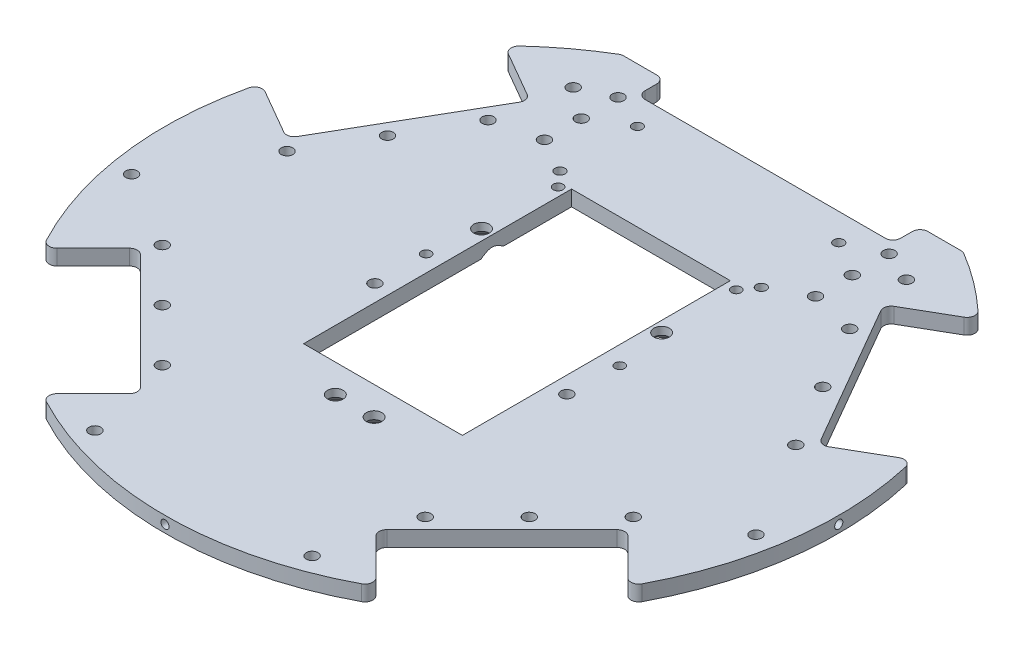
from build123d import *

# Parameters (mm, degrees)
BOSS_EXTRUDE1_DEPTH           = 2
FILLET1_R                     = 2
CSK_FOR_M3_SFHCS1_D           = 3
CSK_FOR_M3_SFHCS1_DEPTH       = 9.5
CSK_FOR_M3_SFHCS1_CSINK_D     = 5.6
CSK_FOR_M3_SFHCS1_CSINK_ANGLE = 90
CSK_FOR_M3_SFHCS1_TIP         = 0.901290929
CSK_FOR_M3_SFHCS2_D           = 3
CSK_FOR_M3_SFHCS2_DEPTH       = 9.5
CSK_FOR_M3_SFHCS2_CSINK_D     = 5.6
CSK_FOR_M3_SFHCS2_CSINK_ANGLE = 90
CSK_FOR_M3_SFHCS2_TIP         = 0.901290929
CSK_FOR_M3_SFHCS3_D           = 2.6
CSK_FOR_M3_SFHCS3_DEPTH       = 9.5
CSK_FOR_M3_SFHCS3_CSINK_D     = 4.6
CSK_FOR_M3_SFHCS3_CSINK_ANGLE = 90
CSK_FOR_M3_SFHCS3_TIP         = 0.781118805
CSK_FOR_M4_SFHCS3_D           = 4
CSK_FOR_M4_SFHCS3_DEPTH       = 9.5
CSK_FOR_M4_SFHCS3_CSINK_D     = 8
CSK_FOR_M4_SFHCS3_CSINK_ANGLE = 90
CSK_FOR_M4_SFHCS3_TIP         = 1.201721238
CSK_FOR_M3_SFHCS4_D           = 3
CSK_FOR_M3_SFHCS4_DEPTH       = 9.5
CSK_FOR_M3_SFHCS4_CSINK_D     = 5.6
CSK_FOR_M3_SFHCS4_CSINK_ANGLE = 90
CSK_FOR_M3_SFHCS4_TIP         = 0.901290929
SKETCH9_R                     = 1.05
CUT_EXTRUDE1_DEPTH            = 8
SKETCH10_R                    = 1.05
CUT_EXTRUDE2_DEPTH            = 8
SKETCH11_R                    = 1.05
CUT_EXTRUDE3_DEPTH            = 8
M2_5X0_45_TAPPED_HOLE1_D      = 2.05
M2_5X0_45_TAPPED_HOLE1_DEPTH  = 6.35
M2_5X0_45_TAPPED_HOLE1_TIP    = 0.615882135
CUT_EXTRUDE4_REACH            = 125.102
SKETCH21_R                    = 1.25
SKETCH23_W                    = 66
SKETCH23_H                    = 4
CUT_EXTRUDE6_DEPTH            = 1
FILLET2_R                     = 2
SKETCH24_W                    = 41
SKETCH24_H                    = 69.2
CUT_EXTRUDE9_DEPTH            = 10


with BuildPart() as part:
    # Sketch1 → Boss-Extrude1 (new, symmetric)
    with BuildSketch(Plane(origin=(0, 0, 0), x_dir=(1, 0, 0), z_dir=(0, 1, 0))):
        with BuildLine():
            Line((45.65767665, 52.918584287), (68.65767665, 13.081415713))
            Line((68.65767665, 13.081415713), (84.163608498, 22.03376964))
            ThreePointArc((84.163608498, 22.03376964), (86.25570294, -11.355778723), (75.593043864, -43.066131929))
            Line((75.593043864, -43.066131929), (62.932503526, -30.405591591))
            Line((62.932503526, -30.405591591), (30.405591591, -62.932503526))
            Line((30.405591591, -62.932503526), (43.066131929, -75.593043864))
            ThreePointArc((43.066131929, -75.593043864), (0, -87), (-43.066131929, -75.593043864))
            Line((-43.066131929, -75.593043864), (-30.405591591, -62.932503526))
            Line((-30.405591591, -62.932503526), (-62.932503526, -30.405591591))
            Line((-62.932503526, -30.405591591), (-75.593043864, -43.066131929))
            ThreePointArc((-75.593043864, -43.066131929), (-86.25570294, -11.355778723), (-84.163608498, 22.03376964))
            Line((-84.163608498, 22.03376964), (-68.65767665, 13.081415713))
            Line((-68.65767665, 13.081415713), (-45.65767665, 52.918584287))
            Line((-45.65767665, 52.918584287), (-61.163608498, 61.870938214))
            ThreePointArc((-61.163608498, 61.870938214), (-53.035049748, 68.965813982), (-44.09081537, 75))
            Line((-44.09081537, 75), (-33, 75))
            Line((-33, 75), (-33, 69))
            Line((-33, 69), (33, 69))
            Line((33, 69), (33, 75))
            Line((33, 75), (44.09081537, 75))
            ThreePointArc((44.09081537, 75), (53.035049748, 68.965813982), (61.163608498, 61.870938214))
            Line((61.163608498, 61.870938214), (45.65767665, 52.918584287))
        make_face()
    extrude(amount=BOSS_EXTRUDE1_DEPTH, both=True)

    # Fillet1
    fillet1_edges = [part.edges().sort_by_distance(p)[0] for p in [
        (33, 0, -75),
        (44.09081537, 0, -75),
        (61.163608498, 0, -61.870938214),
        (45.65767665, 0, -52.918584287),
        (68.65767665, 0, -13.081415713),
        (84.163608498, 0, -22.03376964),
        (75.593043864, 0, 43.066131929),
        (62.932503526, 0, 30.405591591),
        (30.405591591, 0, 62.932503526),
        (43.066131929, 0, 75.593043864),
        (-43.066131929, 0, 75.593043864),
        (-30.405591591, 0, 62.932503526),
        (-62.932503526, 0, 30.405591591),
        (-75.593043864, 0, 43.066131929),
        (-84.163608498, 0, -22.03376964),
        (-68.65767665, 0, -13.081415713),
        (-45.65767665, 0, -52.918584287),
        (-61.163608498, 0, -61.870938214),
        (-44.09081537, 0, -75),
        (-33, 0, -75),
    ]]
    fillet(fillet1_edges, radius=FILLET1_R)

    # CSK for M3 SFHCS1
    with Locations(Plane(origin=(46.693575035, -2, -43.124355653), x_dir=(0, 0, -1), z_dir=(0, -1, 0))):
        with Locations((0, 0), (-16.454482672, 9.5), (-32.908965344, 19), (-69.994413338, 14.117608147), (-83.429442181, 0.682579304), (-96.864471023, -12.752449538), (-96.864471023, -80.634700532), (-83.429442181, -94.069729374), (-69.994413338, -107.504758217), (0, -93.38715007), (-16.454482672, -102.88715007), (-32.908965344, -112.38715007), (21.875644347, -81.693575035), (12.375644347, -81.693575035), (2.875644347, -81.693575035), (2.875644347, -11.693575035), (12.375644347, -11.693575035), (21.875644347, -11.693575035)):
            CounterSinkHole(CSK_FOR_M3_SFHCS1_D / 2, CSK_FOR_M3_SFHCS1_CSINK_D / 2, depth=CSK_FOR_M3_SFHCS1_DEPTH, counter_sink_angle=CSK_FOR_M3_SFHCS1_CSINK_ANGLE)
            with Locations((0, 0, -(CSK_FOR_M3_SFHCS1_DEPTH + CSK_FOR_M3_SFHCS1_TIP / 2))):  # 118° drill point
                Cone(0, CSK_FOR_M3_SFHCS1_D / 2, CSK_FOR_M3_SFHCS1_TIP, mode=Mode.SUBTRACT)

    # CSK for M3 SFHCS2
    with Locations(Plane(origin=(43.018232726, -2, -61.436403322), x_dir=(0, 0, -1), z_dir=(0, -1, 0))):
        with Locations((0, 0), (-76.436403322, 37.598142782), (-138.491198226, -14.972580973), (-138.491198226, -71.063884479), (-76.436403322, -123.634608234), (0, -86.036465452)):
            CounterSinkHole(CSK_FOR_M3_SFHCS2_D / 2, CSK_FOR_M3_SFHCS2_CSINK_D / 2, depth=CSK_FOR_M3_SFHCS2_DEPTH, counter_sink_angle=CSK_FOR_M3_SFHCS2_CSINK_ANGLE)
            with Locations((0, 0, -(CSK_FOR_M3_SFHCS2_DEPTH + CSK_FOR_M3_SFHCS2_TIP / 2))):  # 118° drill point
                Cone(0, CSK_FOR_M3_SFHCS2_D / 2, CSK_FOR_M3_SFHCS2_TIP, mode=Mode.SUBTRACT)

    # CSK for M3 SFHCS3
    with Locations(Plane(origin=(26, -2, -41), x_dir=(0, 0, -1), z_dir=(0, -1, 0))):
        with Locations((0, 0), (20, 0), (0, -52), (20, -52)):
            CounterSinkHole(CSK_FOR_M3_SFHCS3_D / 2, CSK_FOR_M3_SFHCS3_CSINK_D / 2, depth=CSK_FOR_M3_SFHCS3_DEPTH, counter_sink_angle=CSK_FOR_M3_SFHCS3_CSINK_ANGLE)
            with Locations((0, 0, -(CSK_FOR_M3_SFHCS3_DEPTH + CSK_FOR_M3_SFHCS3_TIP / 2))):  # 118° drill point
                Cone(0, CSK_FOR_M3_SFHCS3_D / 2, CSK_FOR_M3_SFHCS3_TIP, mode=Mode.SUBTRACT)

    # CSK for M4 SFHCS3
    with Locations(Plane(origin=(23.25, -2, -18), x_dir=(0, 0, -1), z_dir=(0, -1, 0))):
        with Locations((0, 0), (0, -46.5), (-56, -28.25), (-56, -18.25)):
            CounterSinkHole(CSK_FOR_M4_SFHCS3_D / 2, CSK_FOR_M4_SFHCS3_CSINK_D / 2, depth=CSK_FOR_M4_SFHCS3_DEPTH, counter_sink_angle=CSK_FOR_M4_SFHCS3_CSINK_ANGLE)
            with Locations((0, 0, -(CSK_FOR_M4_SFHCS3_DEPTH + CSK_FOR_M4_SFHCS3_TIP / 2))):  # 118° drill point
                Cone(0, CSK_FOR_M4_SFHCS3_D / 2, CSK_FOR_M4_SFHCS3_TIP, mode=Mode.SUBTRACT)

    # CSK for M3 SFHCS4
    with Locations(Plane(origin=(24.78, -2, 8), x_dir=(0, 0, -1), z_dir=(0, -1, 0))):
        with Locations((0, 0), (0, -49.56)):
            CounterSinkHole(CSK_FOR_M3_SFHCS4_D / 2, CSK_FOR_M3_SFHCS4_CSINK_D / 2, depth=CSK_FOR_M3_SFHCS4_DEPTH, counter_sink_angle=CSK_FOR_M3_SFHCS4_CSINK_ANGLE)
            with Locations((0, 0, -(CSK_FOR_M3_SFHCS4_DEPTH + CSK_FOR_M3_SFHCS4_TIP / 2))):  # 118° drill point
                Cone(0, CSK_FOR_M3_SFHCS4_D / 2, CSK_FOR_M3_SFHCS4_TIP, mode=Mode.SUBTRACT)

    # Sketch9 → Cut-Extrude1 (cut)
    with BuildSketch(Plane(origin=(87, 0, 0), x_dir=(0, 0, -1), z_dir=(1, 0, 0))):
        Circle(SKETCH9_R)
    cut_extrude1 = extrude(amount=-CUT_EXTRUDE1_DEPTH, mode=Mode.SUBTRACT)

    # Sketch10 → Cut-Extrude2 (cut)
    with BuildSketch(Plane.XY.offset(87)):
        Circle(SKETCH10_R)
    cut_extrude2 = extrude(amount=-CUT_EXTRUDE2_DEPTH, mode=Mode.SUBTRACT)

    # Sketch11 → Cut-Extrude3 (cut)
    with BuildSketch(Plane(origin=(52.182278256, 0, -69.613287783), x_dir=(-0.8001527331423806, 0, -0.5997963017931826), z_dir=(0.5997963017931826, 0, -0.8001527331423806))):
        Circle(SKETCH11_R)
    cut_extrude3 = extrude(amount=-CUT_EXTRUDE3_DEPTH, mode=Mode.SUBTRACT)

    # Mirror1: Cut-Extrude1, Cut-Extrude2, Cut-Extrude3 across plane
    add(cut_extrude1.mirror(Plane(origin=(0, 0, 0), x_dir=(0, 0, 1), z_dir=(1, 0, 0))), mode=Mode.SUBTRACT)
    add(cut_extrude2.mirror(Plane(origin=(0, 0, 0), x_dir=(0, 0, 1), z_dir=(1, 0, 0))), mode=Mode.SUBTRACT)
    add(cut_extrude3.mirror(Plane(origin=(0, 0, 0), x_dir=(0, 0, 1), z_dir=(1, 0, 0))), mode=Mode.SUBTRACT)

    # M2.5x0.45 Tapped Hole1
    with Locations(Plane(origin=(-39.271541057, 0, -75), x_dir=(-1, 0, 0), z_dir=(0, 0, -1))):
        with Locations((0, 0), (-78.717182785, 0)):
            Hole(M2_5X0_45_TAPPED_HOLE1_D / 2, depth=M2_5X0_45_TAPPED_HOLE1_DEPTH)
            with Locations((0, 0, -(M2_5X0_45_TAPPED_HOLE1_DEPTH + M2_5X0_45_TAPPED_HOLE1_TIP / 2))):  # 118° drill point
                Cone(0, M2_5X0_45_TAPPED_HOLE1_D / 2, M2_5X0_45_TAPPED_HOLE1_TIP, mode=Mode.SUBTRACT)

    # Sketch21 → Cut-Extrude4 (cut, up to next)
    with BuildSketch(Plane(origin=(0, 2, 0), x_dir=(1, 0, 0), z_dir=(0, 1, 0)), mode=Mode.PRIVATE) as cut_extrude4_sk1:
        with Locations(Location((25.239999926, 5.212655969, 0), (0, 0, 270))):
            Circle(SKETCH21_R)
    cut_extrude4_tool1 = extrude(cut_extrude4_sk1.sketch, amount=-CUT_EXTRUDE4_REACH, mode=Mode.PRIVATE) & part.part
    # Sketch21 → Cut-Extrude4 (cut, up to next)
    with BuildSketch(Plane(origin=(0, 2, 0), x_dir=(1, 0, 0), z_dir=(0, 1, 0)), mode=Mode.PRIVATE) as cut_extrude4_sk2:
        with Locations(Location((23.314999926, 37.212655969, 0), (0, 0, 270))):
            Circle(SKETCH21_R)
    cut_extrude4_tool2 = extrude(cut_extrude4_sk2.sketch, amount=-CUT_EXTRUDE4_REACH, mode=Mode.PRIVATE) & part.part
    # Sketch21 → Cut-Extrude4 (cut, up to next)
    with BuildSketch(Plane(origin=(0, 2, 0), x_dir=(1, 0, 0), z_dir=(0, 1, 0)), mode=Mode.PRIVATE) as cut_extrude4_sk3:
        with Locations(Location((-24.760000074, 5.212655969, 0), (0, 0, 270))):
            Circle(SKETCH21_R)
    cut_extrude4_tool3 = extrude(cut_extrude4_sk3.sketch, amount=-CUT_EXTRUDE4_REACH, mode=Mode.PRIVATE) & part.part
    # Sketch21 → Cut-Extrude4 (cut, up to next)
    with BuildSketch(Plane(origin=(0, 2, 0), x_dir=(1, 0, 0), z_dir=(0, 1, 0)), mode=Mode.PRIVATE) as cut_extrude4_sk4:
        with Locations(Location((-22.685000074, 37.212655969, 0), (0, 0, 270))):
            Circle(SKETCH21_R)
    cut_extrude4_tool4 = extrude(cut_extrude4_sk4.sketch, amount=-CUT_EXTRUDE4_REACH, mode=Mode.PRIVATE) & part.part
    add(cut_extrude4_tool1.solids().sort_by_distance((25.24, 2, -5.212656))[0], mode=Mode.SUBTRACT)
    add(cut_extrude4_tool2.solids().sort_by_distance((23.315, 2, -37.212656))[0], mode=Mode.SUBTRACT)
    add(cut_extrude4_tool3.solids().sort_by_distance((-24.76, 2, -5.212656))[0], mode=Mode.SUBTRACT)
    add(cut_extrude4_tool4.solids().sort_by_distance((-22.685, 2, -37.212656))[0], mode=Mode.SUBTRACT)

    # Sketch23 → Cut-Extrude6 (cut)
    with BuildSketch(Plane(origin=(0, 0, -69), x_dir=(-1, 0, 0), z_dir=(0, 0, -1))):
        Rectangle(SKETCH23_W, SKETCH23_H)
    extrude(amount=-CUT_EXTRUDE6_DEPTH, mode=Mode.SUBTRACT)

    # Fillet2
    fillet2_edges = [part.edges().sort_by_distance(p)[0] for p in [
        (-33, 0, -68),
        (33, 0, -68),
    ]]
    fillet(fillet2_edges, radius=FILLET2_R)

    # Sketch24 → Cut-Extrude9 (cut)
    with BuildSketch(Plane.XZ.offset(2)):
        with Locations((0, -3.9)):
            Rectangle(SKETCH24_W, SKETCH24_H)
    extrude(amount=-CUT_EXTRUDE9_DEPTH, mode=Mode.SUBTRACT)


solid = part.part
